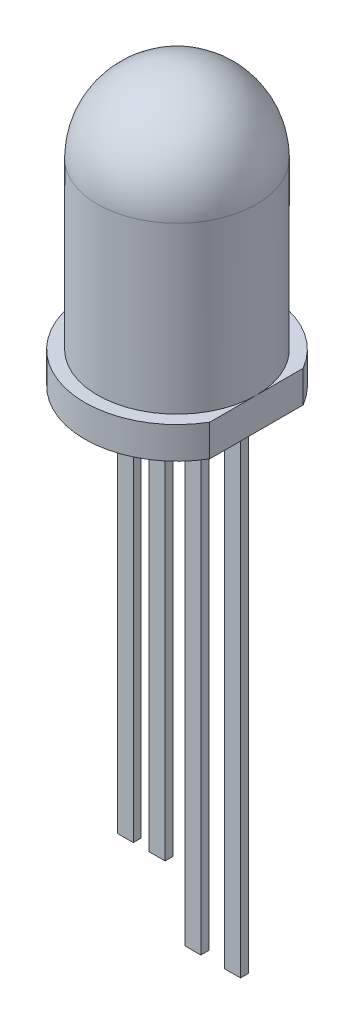
from build123d import *

# Parameters (mm, degrees)
SKETCH2_W           = 0.4
SKETCH2_H           = 2.939387692
CUT_EXTRUDE1_DEPTH  = 10.618211892
SKETCH3_W           = 0.5
SKETCH3_H           = 15
SKETCH3_H_2         = 13
BOSS_EXTRUDE1_DEPTH = 0.125


with BuildPart() as part:
    # Sketch1 → Revolve1 (revolve)
    with BuildSketch(Plane(origin=(0, 0, 0), x_dir=(0, 0, -1), z_dir=(1, 0, 0))):
        with BuildLine():
            Line((0, 0), (2.9, 0))
            Line((2.9, 0), (2.9, 1))
            Line((2.9, 1), (2.5, 1))
            Line((2.5, 1), (2.5, 6.2))
            ThreePointArc((2.5, 6.2), (1.767766953, 7.967766953), (0, 8.7))
            Line((0, 8.7), (0, 0))
        make_face()
    revolve(axis=Axis((0, 0, 0), (0, 1, 0)))

    # Sketch2 → Cut-Extrude1 (cut, through all)
    with BuildSketch(Plane(origin=(0, 0, 0), x_dir=(1, 0, 0), z_dir=(0, 1, 0))):
        with Locations((2.7, 0)):
            Rectangle(SKETCH2_W, SKETCH2_H)
    extrude(amount=CUT_EXTRUDE1_DEPTH, mode=Mode.SUBTRACT)

    # Sketch3 → Boss-Extrude1 (add, symmetric)
    with BuildSketch(Plane.XY):
        with Locations((0.625, -7.5)):
            Rectangle(SKETCH3_W, SKETCH3_H)
        with Locations((1.875, -7.5)):
            Rectangle(SKETCH3_W, SKETCH3_H)
        with Locations((-0.5, -6.5)):
            Rectangle(SKETCH3_W, SKETCH3_H_2)
        with Locations((-1.5, -6.5)):
            Rectangle(SKETCH3_W, SKETCH3_H_2)
    extrude(amount=BOSS_EXTRUDE1_DEPTH, both=True)


solid = part.part
